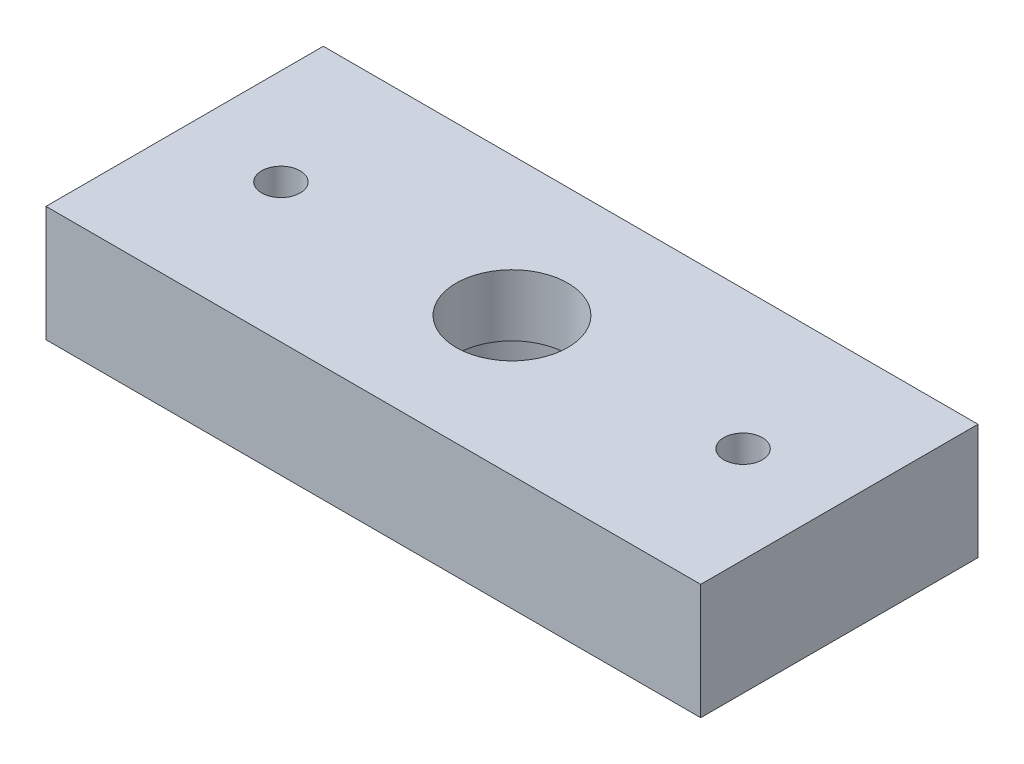
from build123d import *

# Parameters (mm, degrees)
SKETCH1_W           = 85
SKETCH1_H           = 36
SKETCH1_R           = 7.25
SKETCH1_R_2         = 2.5
BOSS_EXTRUDE1_DEPTH = 15
SKETCH2_R           = 11
CUT_EXTRUDE1_DEPTH  = 7


with BuildPart() as part:
    # Sketch1 → Boss-Extrude1 (new body)
    with BuildSketch(Plane(origin=(0, 0, 0), x_dir=(1, 0, 0), z_dir=(0, 1, 0))):
        Rectangle(SKETCH1_W, SKETCH1_H)
        with Locations(Location((0, 0, 0), (0, 0, 270))):
            Circle(SKETCH1_R, mode=Mode.SUBTRACT)
        with Locations(Location((-30, 0, 0), (0, 0, 270))):
            Circle(SKETCH1_R_2, mode=Mode.SUBTRACT)
        with Locations(Location((30, 0, 0), (0, 0, 270))):
            Circle(SKETCH1_R_2, mode=Mode.SUBTRACT)
    extrude(amount=BOSS_EXTRUDE1_DEPTH)

    # Sketch2 → Cut-Extrude1 (cut)
    with BuildSketch(Plane(origin=(0, 0, 0), x_dir=(1, 0, 0), z_dir=(0, 1, 0))):
        with Locations(Location((0, 0, 0), (0, 0, 270))):
            Circle(SKETCH2_R)
    extrude(amount=CUT_EXTRUDE1_DEPTH, mode=Mode.SUBTRACT)


solid = part.part
